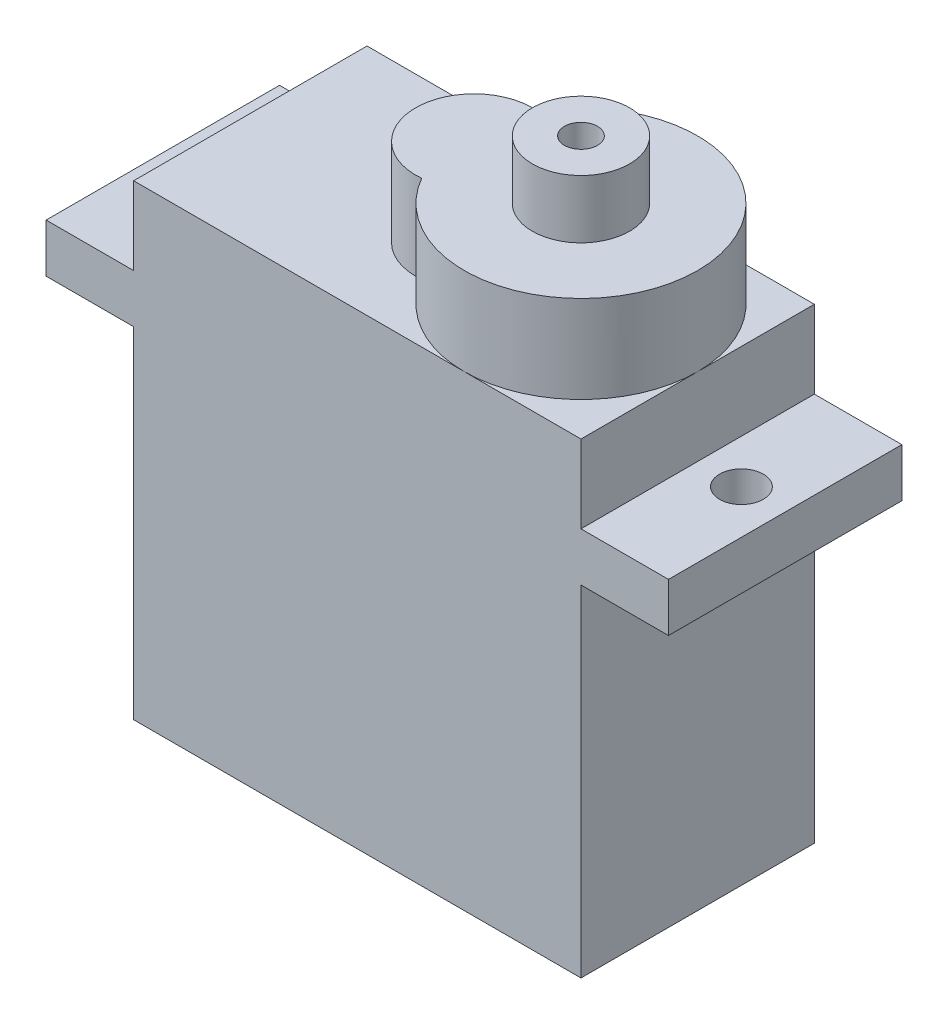
from build123d import *

# Parameters (mm, degrees)
SKETCH1_W           = 23
SKETCH1_H           = 12
BOSS_EXTRUDE1_DEPTH = 24
BOSS_EXTRUDE2_DEPTH = 4.5
SKETCH3_R           = 2.5
BOSS_EXTRUDE3_DEPTH = 3
SKETCH4_R           = 0.85
CUT_EXTRUDE1_DEPTH  = 5
BOSS_EXTRUDE4_START = -4
SKETCH5_W           = 4.5
SKETCH5_H           = 12
SKETCH5_R           = 1.125
BOSS_EXTRUDE4_DEPTH = 2.5


with BuildPart() as part:
    # Sketch1 → Boss-Extrude1 (new body)
    with BuildSketch(Plane(origin=(0, 0, 0), x_dir=(1, 0, 0), z_dir=(0, 1, 0))):
        Rectangle(SKETCH1_W, SKETCH1_H)
    extrude(amount=BOSS_EXTRUDE1_DEPTH)

    # Sketch2 → Boss-Extrude2 (add)
    with BuildSketch(Plane(origin=(0, 24, 0), x_dir=(1, 0, 0), z_dir=(0, 1, 0))):
        with BuildLine():
            ThreePointArc((0.295454545, 2.985415651), (-3, 0), (0.295454545, -2.985415651))
            ThreePointArc((0.295454545, -2.985415651), (11.5, 0), (0.295454545, 2.985415651))
        make_face()
    extrude(amount=BOSS_EXTRUDE2_DEPTH)

    # Sketch3 → Boss-Extrude3 (add)
    with BuildSketch(Plane(origin=(0, 28.5, 0), x_dir=(1, 0, 0), z_dir=(0, 1, 0))):
        with Locations(Location((5.5, 0, 0), (0, 0, 270))):
            Circle(SKETCH3_R)
    extrude(amount=BOSS_EXTRUDE3_DEPTH)

    # Sketch4 → Cut-Extrude1 (cut)
    with BuildSketch(Plane(origin=(0, 31.5, 0), x_dir=(1, 0, 0), z_dir=(0, 1, 0))):
        with Locations(Location((5.5, 0, 0), (0, 0, 270))):
            Circle(SKETCH4_R)
    extrude(amount=-CUT_EXTRUDE1_DEPTH, mode=Mode.SUBTRACT)

    # Sketch5 → Boss-Extrude4 (add)
    # profile 1 of 2: a face of its own
    with BuildSketch(Plane(origin=(0, 24, 0), x_dir=(1, 0, 0), z_dir=(0, 1, 0)).offset(BOSS_EXTRUDE4_START)):
        with Locations((-13.75, 0)):
            Rectangle(SKETCH5_W, SKETCH5_H)
        with Locations(Location((-13.75, 0, 0), (0, 0, 270))):
            Circle(SKETCH5_R, mode=Mode.SUBTRACT)
    # profile 2 of 2: a face of its own
    with BuildSketch(Plane(origin=(0, 24, 0), x_dir=(1, 0, 0), z_dir=(0, 1, 0)).offset(BOSS_EXTRUDE4_START)):
        with Locations((13.75, 0)):
            Rectangle(SKETCH5_W, SKETCH5_H)
        with Locations(Location((13.75, 0, 0), (0, 0, 90))):
            Circle(SKETCH5_R, mode=Mode.SUBTRACT)
    extrude(amount=-BOSS_EXTRUDE4_DEPTH)


solid = part.part
